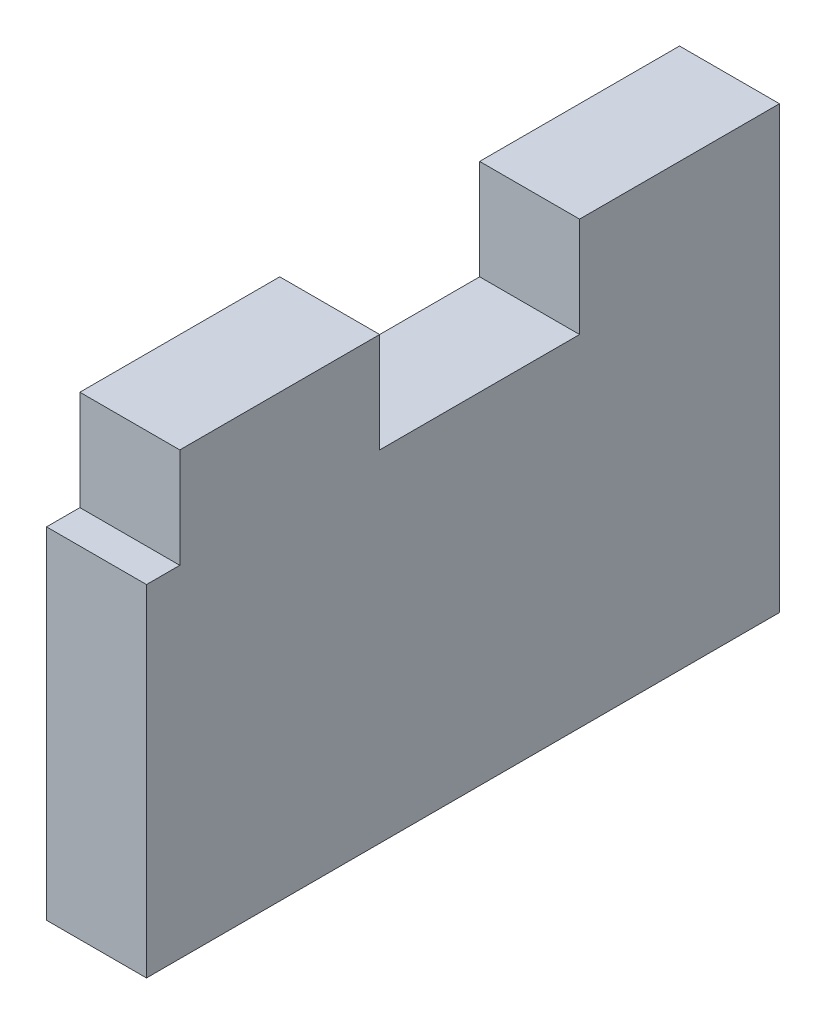
from build123d import *

# Parameters (mm, degrees)
BOSS_EXTRUDE1_DEPTH = 9.525


with BuildPart() as part:
    # Sketch1 → Boss-Extrude1 (new body)
    with BuildSketch(Plane(origin=(0, 0, 0), x_dir=(0, 0, -1), z_dir=(1, 0, 0))):
        Polygon((41.275, 41.999916), (60.325, 41.999916), (60.325, 0), (0, 0), (0, 32.474916), (3.175, 32.474916), (3.175, 41.999916), (22.225, 41.999916), (22.225, 32.474916), (41.275, 32.474916), align=None)
    extrude(amount=BOSS_EXTRUDE1_DEPTH)


solid = part.part
